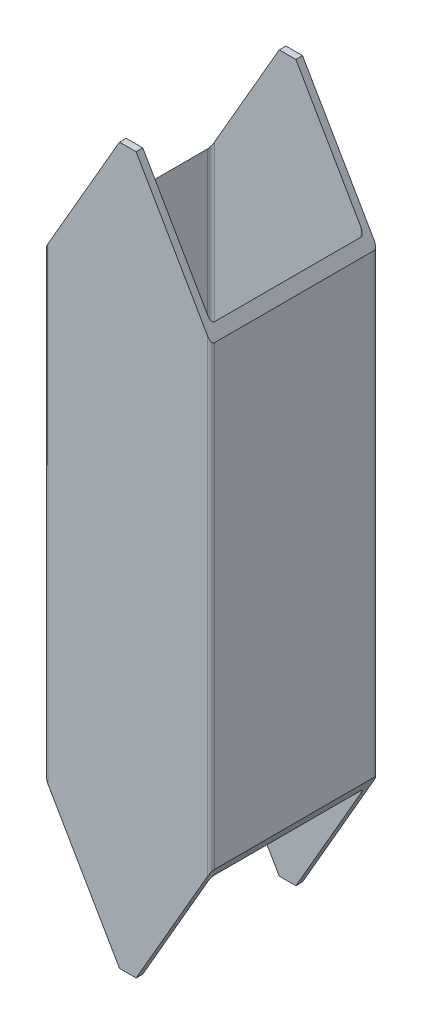
from build123d import *

# Parameters (mm, degrees)
BOSS_EXTRU_1_DEPTH      = 430
ENL_V_MAT_EXTRU_1_DEPTH = 453.65881191


with BuildPart() as part:
    # Esquisse2 → Boss.-Extru.1 (new body)
    with BuildSketch(Plane(origin=(0, 0, 0), x_dir=(1, 0, 0), z_dir=(0, 1, 0))):
        with BuildLine():
            Line((2, 0), (98, 0))
            ThreePointArc((98, 0), (99.414213562, 0.585786438), (100, 2))
            Line((100, 2), (100, 98))
            ThreePointArc((100, 98), (99.414213562, 99.414213562), (98, 100))
            Line((98, 100), (2, 100))
            ThreePointArc((2, 100), (0.585786438, 99.414213562), (0, 98))
            Line((0, 98), (0, 2))
            ThreePointArc((0, 2), (0.585786438, 0.585786438), (2, 0))
        make_face()
        with BuildLine():
            Line((6, 96), (94, 96))
            ThreePointArc((94, 96), (95.414213562, 95.414213562), (96, 94))
            Line((96, 94), (96, 6))
            ThreePointArc((96, 6), (95.414213562, 4.585786438), (94, 4))
            Line((94, 4), (6, 4))
            ThreePointArc((6, 4), (4.585786438, 4.585786438), (4, 6))
            Line((4, 6), (4, 94))
            ThreePointArc((4, 94), (4.585786438, 95.414213562), (6, 96))
        make_face(mode=Mode.SUBTRACT)
    extrude(amount=BOSS_EXTRU_1_DEPTH)

    # Esquisse3 → Enlèv. mat.-Extru.1 (cut, through all)
    with BuildSketch(Plane.XY):
        Polygon((45, 430), (0, 352.057713659), (-62.450183936, 352.057713659), (-62.450183936, 486.30167962), (45, 486.30167962), align=None)
        Polygon((45, 0), (0, 77.942286341), (-44.197295574, 77.942286341), (-44.197295574, -11.830713302), (45, -11.830713302), align=None)
        Polygon((55, -11.830713302), (55, 0), (100, 77.942286341), (144.197295574, 77.942286341), (144.197295574, -11.830713302), align=None)
        Polygon((55, 486.30167962), (55, 430), (100, 352.057713659), (162.450183936, 352.057713659), (162.450183936, 486.30167962), align=None)
    extrude(amount=-ENL_V_MAT_EXTRU_1_DEPTH, mode=Mode.SUBTRACT)


solid = part.part
